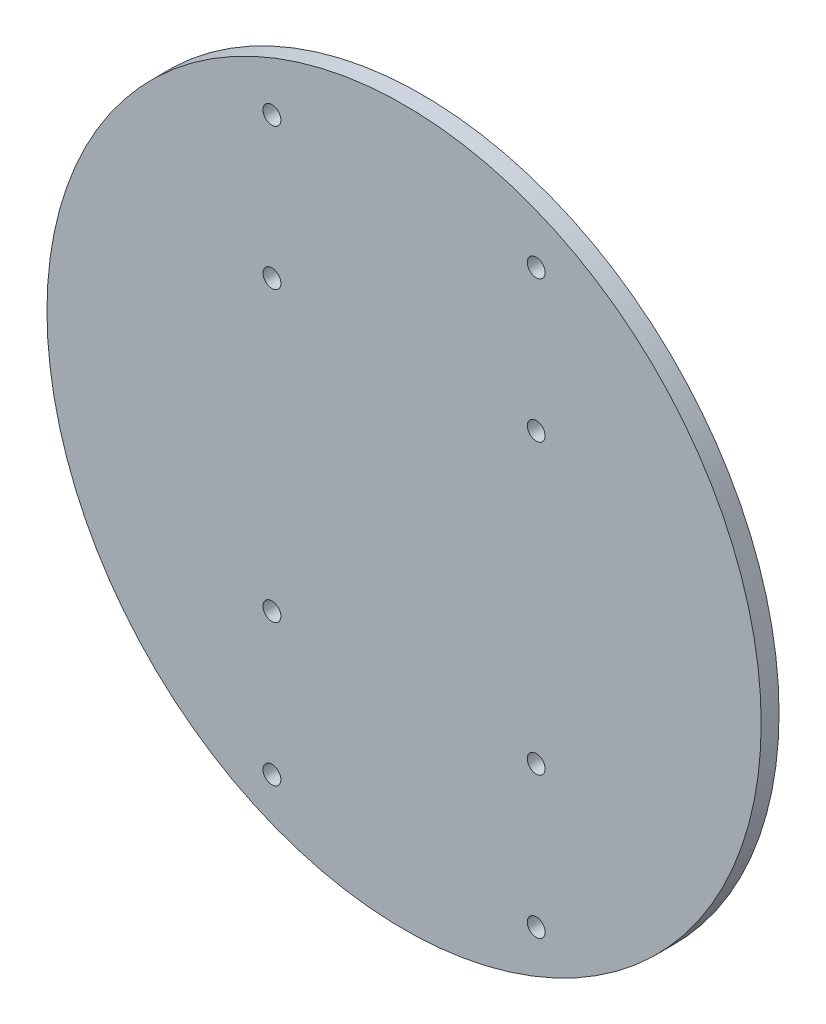
from build123d import *

# Parameters (mm, degrees)
CROQUIS1_R              = 82.42
SALIENTE_EXTRUIR1_DEPTH = 5
CROQUIS2_R              = 100
SALIENTE_EXTRUIR2_DEPTH = 5
CROQUIS3_R              = 2.5
CORTAR_EXTRUIR1_DEPTH   = 10
CROQUIS4_R              = 2.5
CORTAR_EXTRUIR2_DEPTH   = 10


with BuildPart() as part:
    # Croquis1 → Saliente-Extruir1 (new body)
    with BuildSketch(Plane.XY):
        Circle(CROQUIS1_R)
    extrude(amount=SALIENTE_EXTRUIR1_DEPTH)

    # Croquis2 → Saliente-Extruir2 (add)
    with BuildSketch(Plane.XY.offset(5)):
        Circle(CROQUIS2_R)
    extrude(amount=-SALIENTE_EXTRUIR2_DEPTH)

    # Croquis3 → Cortar-Extruir1 (cut)
    with BuildSketch(Plane.XY.offset(5)):
        with Locations((-37, -80.903175403)):
            Circle(CROQUIS3_R)
        with Locations((37, -80.903175403)):
            Circle(CROQUIS3_R)
        with Locations((-37, -41.303175403)):
            Circle(CROQUIS3_R)
        with Locations((37, -41.303175403)):
            Circle(CROQUIS3_R)
    extrude(amount=-CORTAR_EXTRUIR1_DEPTH, mode=Mode.SUBTRACT)

    # Croquis4 → Cortar-Extruir2 (cut)
    with BuildSketch(Plane.XY.offset(5)):
        with Locations((-37, -41.303175403)):
            Circle(CROQUIS4_R)
        with Locations((-37, 39.446824597)):
            Circle(CROQUIS4_R)
        with Locations((-37, -80.903175403)):
            Circle(CROQUIS4_R)
        with Locations((-37, 79.046824597)):
            Circle(CROQUIS4_R)
        with Locations((37, -41.303175403)):
            Circle(CROQUIS4_R)
        with Locations((37, 79.046824597)):
            Circle(CROQUIS4_R)
        with Locations((37, 39.446824597)):
            Circle(CROQUIS4_R)
    extrude(amount=-CORTAR_EXTRUIR2_DEPTH, mode=Mode.SUBTRACT)


solid = part.part
